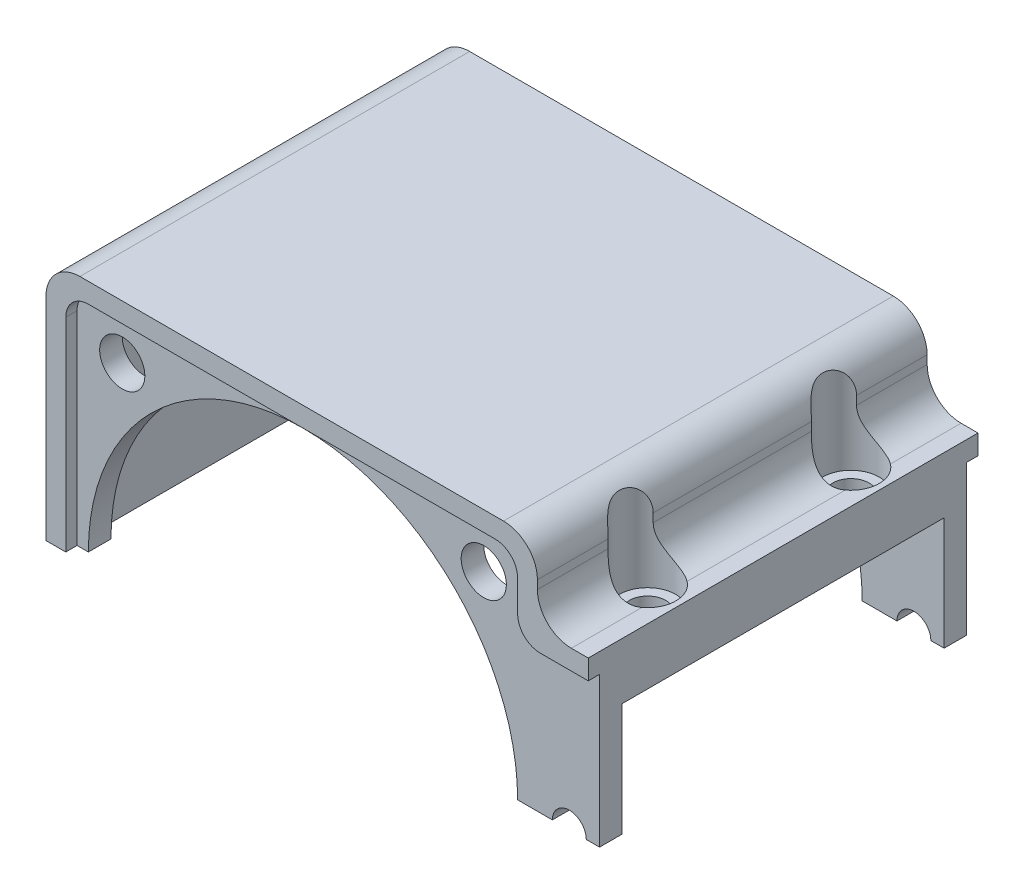
from build123d import *

# Parameters (mm, degrees)
EXTRUDE_1_DEPTH          = 28.5
EXTRUDE_2_DEPTH          = 3
EXTRUDE_START            = 3
EXTRUDE_3_DEPTH          = 3
CUT_EXTRUDE_1_DEPTH      = 1
CUT_EXTRUDE_START        = -1
CUT_EXTRUDE_2_DEPTH      = 1
SKETCH_6_R               = 2
CUT_EXTRUDE_3_DEPTH      = 33
CUT_EXTRUDE_5_DEPTH      = 6
CUT_EXTRUDE_5_DEPTH_BACK = 6
SKETCH_7_R               = 1.6
CUT_EXTRUDE_6_DEPTH      = 6
CUT_EXTRUDE_6_DEPTH_BACK = 2
SKETCH_8_R               = 2.5
CUT_EXTRUDE_START_2      = 30.5
CUT_EXTRUDE_7_DEPTH      = 32.5


with BuildPart() as part:
    # 草图1 → 凸台-拉伸1 (new body)
    with BuildSketch(Plane.XY):
        with BuildLine():
            Line((-20.25, 0), (-20.25, 17.25))
            ThreePointArc((-20.25, 17.25), (-19.371320344, 19.371320344), (-17.25, 20.25))
            Line((-17.25, 20.25), (17.25, 20.25))
            ThreePointArc((17.25, 20.25), (19.371320344, 19.371320344), (20.25, 17.25))
            Line((20.25, 17.25), (20.25, 13))
            ThreePointArc((20.25, 13), (21.128679656, 10.878679656), (23.25, 10))
            Line((23.25, 10), (26.25, 10))
            Line((26.25, 10), (26.25, 15))
            Line((26.25, 15), (24.75, 15))
            ThreePointArc((24.75, 15), (22.628679656, 15.878679656), (21.75, 18))
            Line((21.75, 18), (21.75, 18.75))
            ThreePointArc((21.75, 18.75), (20.871320344, 20.871320344), (18.75, 21.75))
            Line((18.75, 21.75), (0, 21.75))
            Line((0, 21.75), (-18.75, 21.75))
            ThreePointArc((-18.75, 21.75), (-20.871320344, 20.871320344), (-21.75, 18.75))
            Line((-21.75, 18.75), (-21.75, 0))
            Line((-21.75, 0), (-20.25, 0))
        make_face()
    extrude(amount=EXTRUDE_1_DEPTH)

    # 草图2 → 凸台-拉伸2 (add)
    with BuildSketch(Plane.XY.offset(28.5)):
        with BuildLine():
            Line((-21.75, 0), (26.25, 0))
            Line((26.25, 0), (26.25, 15))
            Line((26.25, 15), (24.75, 15))
            ThreePointArc((24.75, 15), (22.628679656, 15.878679656), (21.75, 18))
            Line((21.75, 18), (21.75, 18.75))
            ThreePointArc((21.75, 18.75), (20.871320344, 20.871320344), (18.75, 21.75))
            Line((18.75, 21.75), (-18.75, 21.75))
            ThreePointArc((-18.75, 21.75), (-20.871320344, 20.871320344), (-21.75, 18.75))
            Line((-21.75, 18.75), (-21.75, 0))
        make_face()
    extrude(amount=EXTRUDE_2_DEPTH)

    # 草图3 → 凸台-拉伸3 (add)
    with BuildSketch(Plane(origin=(0, 0, 0), x_dir=(-1, 0, 0), z_dir=(0, 0, -1)).offset(EXTRUDE_START)):
        with BuildLine():
            Line((21.75, 0), (-26.25, 0))
            Line((-26.25, 0), (-26.25, 15))
            Line((-26.25, 15), (-24.75, 15))
            ThreePointArc((-24.75, 15), (-22.628679656, 15.878679656), (-21.75, 18))
            Line((-21.75, 18), (-21.75, 18.75))
            ThreePointArc((-21.75, 18.75), (-20.871320344, 20.871320344), (-18.75, 21.75))
            Line((-18.75, 21.75), (18.75, 21.75))
            ThreePointArc((18.75, 21.75), (20.871320344, 20.871320344), (21.75, 18.75))
            Line((21.75, 18.75), (21.75, 0))
        make_face()
    extrude(amount=-EXTRUDE_3_DEPTH)

    # 草图4 → 切除-拉伸1 (cut)
    with BuildSketch(Plane.XY.offset(31.5)):
        with BuildLine():
            Line((26.25, 13.25), (26.25, 0))
            Line((26.25, 0), (-20, 0))
            Line((-20, 0), (-20, 18))
            ThreePointArc((-20, 18), (-19.414213562, 19.414213562), (-18, 20))
            Line((-18, 20), (18, 20))
            ThreePointArc((18, 20), (19.414213562, 19.414213562), (20, 18))
            Line((20, 18), (20, 15.25))
            ThreePointArc((20, 15.25), (20.585786438, 13.835786438), (22, 13.25))
            Line((22, 13.25), (26.25, 13.25))
        make_face()
    extrude(amount=-CUT_EXTRUDE_1_DEPTH, mode=Mode.SUBTRACT)

    # 草图5 → 切除-拉伸2 (cut)
    with BuildSketch(Plane(origin=(0, 0, -3), x_dir=(-1, 0, 0), z_dir=(0, 0, -1)).offset(CUT_EXTRUDE_START)):
        with BuildLine():
            Line((0, 0), (20, 0))
            Line((20, 0), (20, 18))
            ThreePointArc((20, 18), (19.414213562, 19.414213562), (18, 20))
            Line((18, 20), (-18, 20))
            ThreePointArc((-18, 20), (-19.414213562, 19.414213562), (-20, 18))
            Line((-20, 18), (-20, 15.25))
            ThreePointArc((-20, 15.25), (-20.585786438, 13.835786438), (-22, 13.25))
            Line((-22, 13.25), (-26.25, 13.25))
            Line((-26.25, 13.25), (-26.25, 0))
            Line((-26.25, 0), (0, 0))
        make_face()
    extrude(amount=CUT_EXTRUDE_2_DEPTH, mode=Mode.SUBTRACT)

    # 草图6 → 切除-拉伸3 (cut)
    with BuildSketch(Plane.XY.offset(30.5)):
        with Locations(Location((-16, 16, 0), (0, 0, 180))):
            Circle(SKETCH_6_R)
        with Locations(Location((16, 16, 0), (0, 0, 180))):
            Circle(SKETCH_6_R)
        with BuildLine():
            Line((22.074047969, 0), (25.074047969, 0))
            ThreePointArc((25.074047969, 0), (23.574047969, 1.5), (22.074047969, 0))
        make_face()
        with BuildLine():
            Line((-11.543902494, 13.665222838), (-5.052849459, 7.174169802))
            ThreePointArc((-5.052849459, 7.174169802), (-4.48601855, 6.891164125), (-3.86288238, 7.005579185))
            ThreePointArc((-3.86288238, 7.005579185), (-3.061467459, 7.39103626), (-2.222222222, 7.685162874))
            ThreePointArc((-2.222222222, 7.685162874), (-1.700694746, 8.04488302), (-1.5, 8.645808233))
            Line((-1.5, 8.645808233), (-1.5, 17.82554347))
            ThreePointArc((-1.5, 17.82554347), (-1.843832677, 18.580158898), (-2.638888889, 18.815851441))
            ThreePointArc((-2.638888889, 18.815851441), (-7.270985215, 17.553711118), (-11.438839919, 15.170792376))
            ThreePointArc((-11.438839919, 15.170792376), (-11.834369763, 14.441942942), (-11.543902494, 13.665222838))
        make_face()
        with BuildLine():
            Line((1.5, 17.82554347), (1.5, 8.645808233))
            ThreePointArc((1.5, 8.645808233), (1.700694746, 8.04488302), (2.222222222, 7.685162874))
            ThreePointArc((2.222222222, 7.685162874), (3.061467459, 7.39103626), (3.86288238, 7.005579185))
            ThreePointArc((3.86288238, 7.005579185), (4.48601855, 6.891164125), (5.052849459, 7.174169802))
            Line((5.052849459, 7.174169802), (11.543902494, 13.665222838))
            ThreePointArc((11.543902494, 13.665222838), (11.834369763, 14.441942942), (11.438839919, 15.170792376))
            ThreePointArc((11.438839919, 15.170792376), (7.270985215, 17.553711118), (2.638888889, 18.815851441))
            ThreePointArc((2.638888889, 18.815851441), (1.843832677, 18.580158898), (1.5, 17.82554347))
        make_face()
        with BuildLine():
            Line((13.665222838, 11.543902494), (7.174169802, 5.052849459))
            ThreePointArc((7.174169802, 5.052849459), (6.891164125, 4.48601855), (7.005579185, 3.86288238))
            ThreePointArc((7.005579185, 3.86288238), (7.39103626, 3.061467459), (7.685162874, 2.222222222))
            ThreePointArc((7.685162874, 2.222222222), (8.04488302, 1.700694746), (8.645808233, 1.5))
            Line((8.645808233, 1.5), (17.82554347, 1.5))
            ThreePointArc((17.82554347, 1.5), (18.580158898, 1.843832677), (18.815851441, 2.638888889))
            ThreePointArc((18.815851441, 2.638888889), (17.553711118, 7.270985215), (15.170792376, 11.438839919))
            ThreePointArc((15.170792376, 11.438839919), (14.441942942, 11.834369763), (13.665222838, 11.543902494))
        make_face()
        with BuildLine():
            Line((-4, 0), (4, 0))
            ThreePointArc((4, 0), (0, 4), (-4, 0))
        make_face()
        with BuildLine():
            Line((-17.82554347, 1.5), (-8.645808233, 1.5))
            ThreePointArc((-8.645808233, 1.5), (-8.04488302, 1.700694746), (-7.685162874, 2.222222222))
            ThreePointArc((-7.685162874, 2.222222222), (-7.39103626, 3.061467459), (-7.005579185, 3.86288238))
            ThreePointArc((-7.005579185, 3.86288238), (-6.891164125, 4.48601855), (-7.174169802, 5.052849459))
            Line((-7.174169802, 5.052849459), (-13.665222838, 11.543902494))
            ThreePointArc((-13.665222838, 11.543902494), (-14.441942942, 11.834369763), (-15.170792376, 11.438839919))
            ThreePointArc((-15.170792376, 11.438839919), (-17.553711118, 7.270985215), (-18.815851441, 2.638888889))
            ThreePointArc((-18.815851441, 2.638888889), (-18.580158898, 1.843832677), (-17.82554347, 1.5))
        make_face()
    extrude(amount=-CUT_EXTRUDE_3_DEPTH, mode=Mode.SUBTRACT)

    # 草图7 → 切除-拉伸5 (cut, two sides: drawn at the far end of the back side and taken through both)
    with BuildSketch(Plane(origin=(0, 15, 0), x_dir=(1, 0, 0), z_dir=(0, 1, 0)).offset(-CUT_EXTRUDE_5_DEPTH_BACK)):
        with Locations(Location((23.25, -5.25, 0), (0, 0, 270))):
            Circle(SKETCH_7_R)
        with Locations(Location((23.25, -23.25, 0), (0, 0, 270))):
            Circle(SKETCH_7_R)
    extrude(amount=CUT_EXTRUDE_5_DEPTH + CUT_EXTRUDE_5_DEPTH_BACK, mode=Mode.SUBTRACT)

    # 草图8 → 切除-拉伸6 (cut, two sides: drawn at the far end of the back side and taken through both)
    with BuildSketch(Plane(origin=(0, 15, 0), x_dir=(1, 0, 0), z_dir=(0, 1, 0)).offset(-CUT_EXTRUDE_6_DEPTH_BACK)):
        with Locations(Location((23.25, -5.25, 0), (0, 0, 270))):
            Circle(SKETCH_8_R)
        with Locations(Location((23.25, -23.25, 0), (0, 0, 270))):
            Circle(SKETCH_8_R)
    extrude(amount=CUT_EXTRUDE_6_DEPTH + CUT_EXTRUDE_6_DEPTH_BACK, mode=Mode.SUBTRACT)

    # 草图9 → 切除-拉伸7 (cut)
    with BuildSketch(Plane.XY.offset(CUT_EXTRUDE_START_2)):
        with BuildLine():
            Line((-19, 0), (19, 0))
            ThreePointArc((19, 0), (3.706716118, 18.634920328), (-17.553711118, 7.270985215))
            ThreePointArc((-17.553711118, 7.270985215), (-18.634920328, 3.706716118), (-19, 0))
        make_face()
    extrude(amount=-CUT_EXTRUDE_7_DEPTH, mode=Mode.SUBTRACT)


solid = part.part
